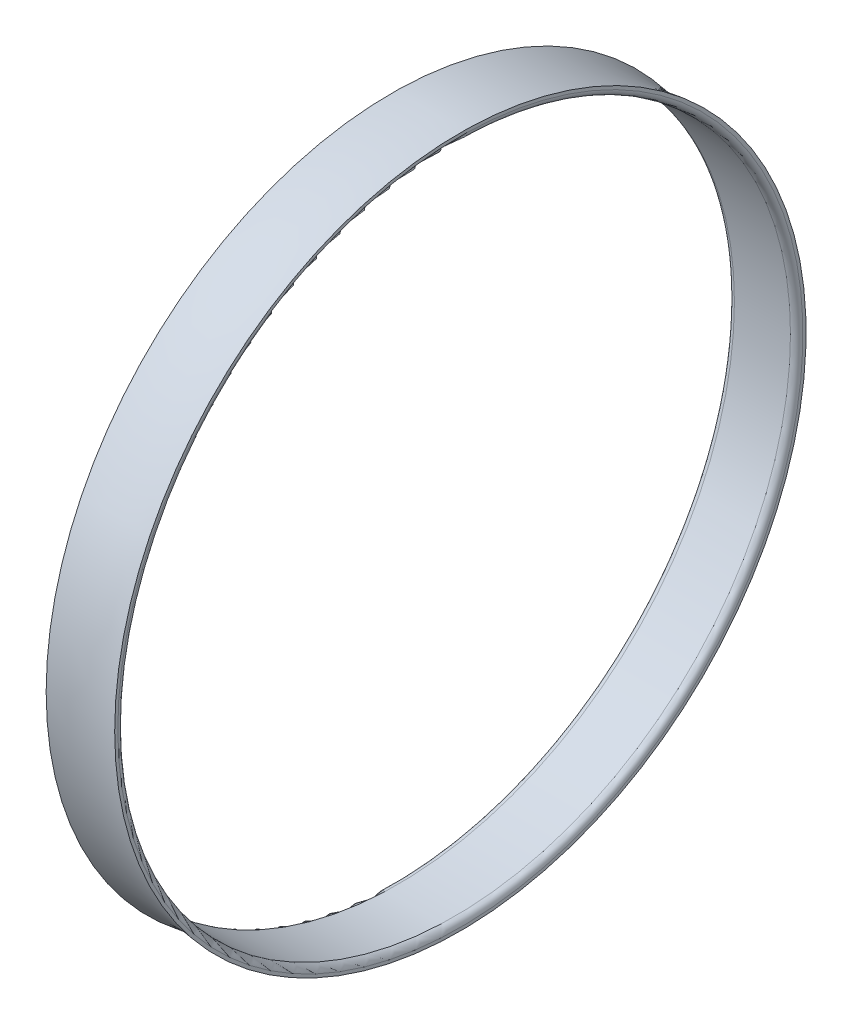
from build123d import *


with BuildPart() as part:
    # Szkic1 → Obrót1 (revolve)
    with BuildSketch(Plane.XY, mode=Mode.PRIVATE) as obr_t1_sk:
        with BuildLine():
            Line((5.785570362, 53.997225536), (14.785570362, 53.997225536))
            ThreePointArc((14.785570362, 53.997225536), (15.492677143, 54.290118755), (15.785570362, 54.997225536))
            Line((15.785570362, 54.997225536), (15.785570362, 55.5))
            ThreePointArc((15.785570362, 55.5), (10.285570362, 54.991524206), (4.785570362, 55.5))
            Line((4.785570362, 55.5), (4.785570362, 54.997225536))
            ThreePointArc((4.785570362, 54.997225536), (5.078463581, 54.290118755), (5.785570362, 53.997225536))
        make_face()
    revolve(obr_t1_sk.sketch.rotate(Axis((-59.633930429, 0, 0), (1, 0, 0)), 90), axis=Axis((-59.633930429, 0, 0), (1, 0, 0)))


solid = part.part
